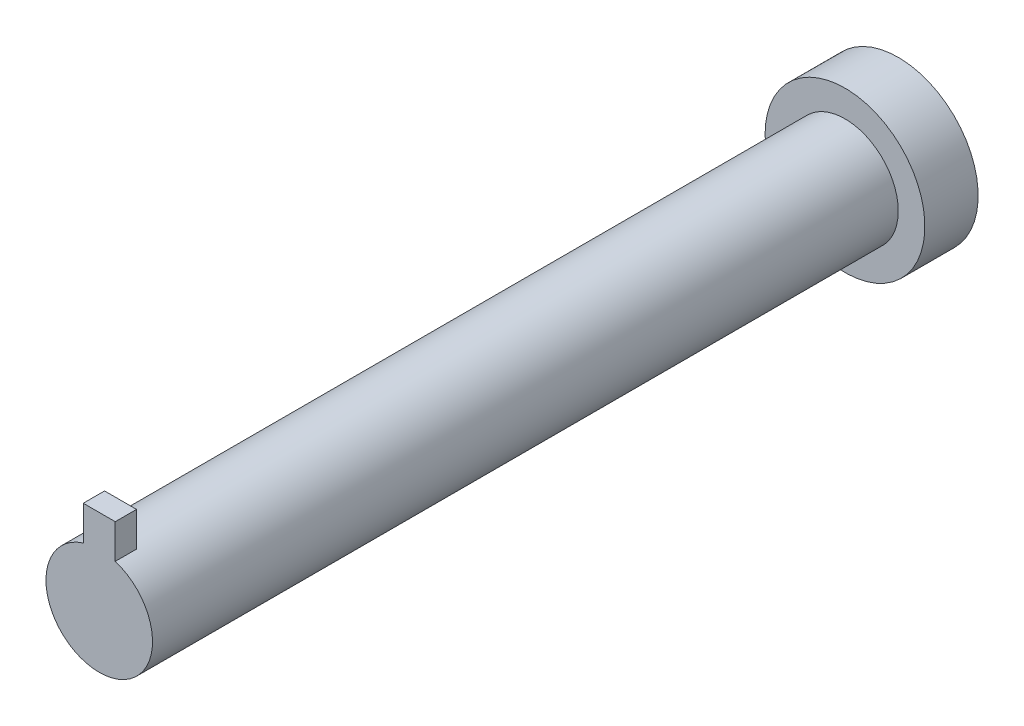
from build123d import *

# Parameters (mm, degrees)
IZIM1_R                     = 5
Y_KSEKLIK_EKSTR_ZYON1_DEPTH = 70
IZIM2_R                     = 7.5
Y_KSEKLIK_EKSTR_ZYON2_DEPTH = 5
IZIM3_W                     = 3
IZIM3_H                     = 2
Y_KSEKLIK_EKSTR_ZYON3_DEPTH = 8


with BuildPart() as part:
    # Çizim1 → Yükseklik-Ekstrüzyon1 (new body)
    with BuildSketch(Plane.XY):
        Circle(IZIM1_R)
    extrude(amount=Y_KSEKLIK_EKSTR_ZYON1_DEPTH)

    # Çizim2 → Yükseklik-Ekstrüzyon2 (add)
    with BuildSketch(Plane(origin=(0, 0, 0), x_dir=(-1, 0, 0), z_dir=(0, 0, -1))):
        Circle(IZIM2_R)
    extrude(amount=Y_KSEKLIK_EKSTR_ZYON2_DEPTH)

    # Çizim3 → Yükseklik-Ekstrüzyon3 (add)
    with BuildSketch(Plane(origin=(0, 0, 0), x_dir=(1, 0, 0), z_dir=(0, 1, 0))):
        with Locations((0, -69)):
            Rectangle(IZIM3_W, IZIM3_H)
    extrude(amount=Y_KSEKLIK_EKSTR_ZYON3_DEPTH)


solid = part.part
